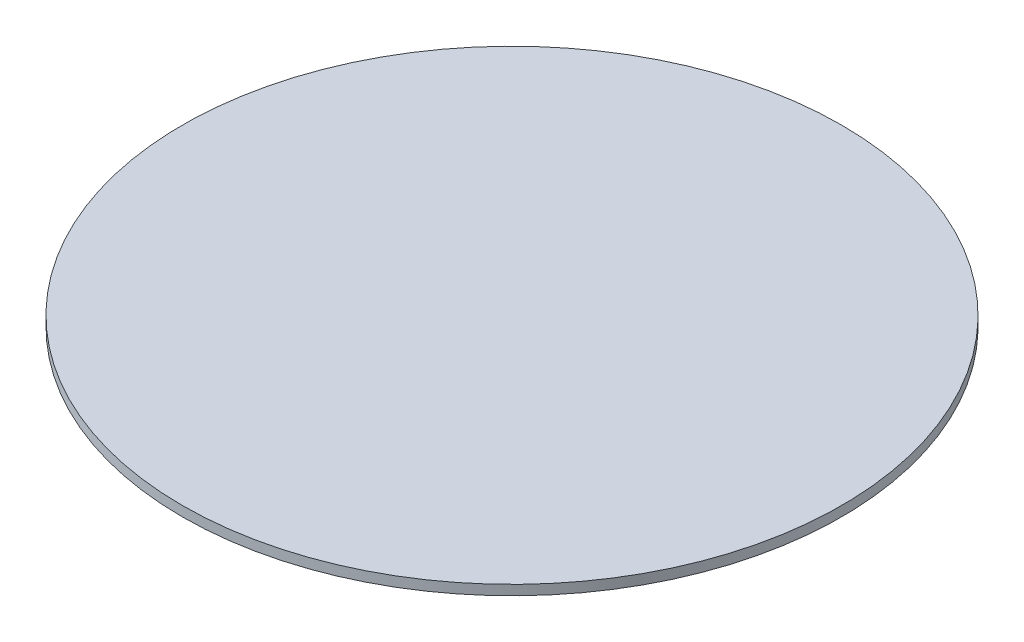
from build123d import *

# Parameters (mm, degrees)
SKETCH2_R           = 50
BOSS_EXTRUDE1_DEPTH = 1.5


with BuildPart() as part:
    # Sketch2 → Boss-Extrude1 (new body)
    with BuildSketch(Plane(origin=(0, 0, 0), x_dir=(1, 0, 0), z_dir=(0, 1, 0))):
        with Locations(Location((0, 0, 0), (0, 0, 270))):
            Circle(SKETCH2_R)
    extrude(amount=BOSS_EXTRUDE1_DEPTH)


solid = part.part
